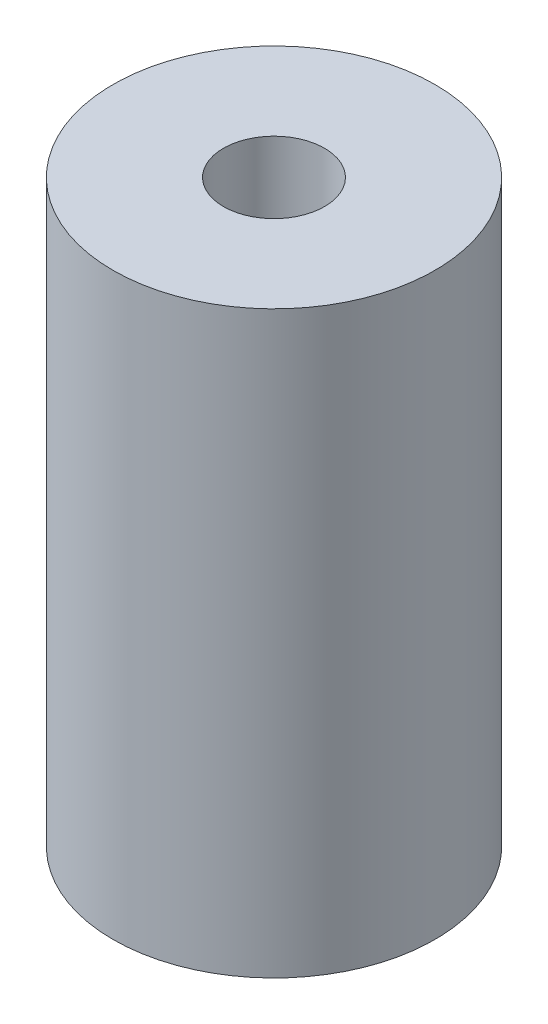
from build123d import *

# Parameters (mm, degrees)
SKETCH1_R             = 3.175
BOSS_EXTRUDE1_DEPTH   = 11.43
F_3_48_TAPPED_HOLE1_D = 1.9939


with BuildPart() as part:
    # Sketch1 → Boss-Extrude1 (new body)
    with BuildSketch(Plane(origin=(0, 0, 0), x_dir=(1, 0, 0), z_dir=(0, 1, 0))):
        with Locations(Location((0, 0, 0), (0, 0, 270))):
            Circle(SKETCH1_R)
    extrude(amount=BOSS_EXTRUDE1_DEPTH)

    # #3-48 Tapped Hole1 (through all)
    with Locations(Plane(origin=(0, 11.43, 0), x_dir=(1, 0, 0), z_dir=(0, 1, 0))):
        with Locations((0, 0)):
            Hole(F_3_48_TAPPED_HOLE1_D / 2)


solid = part.part
